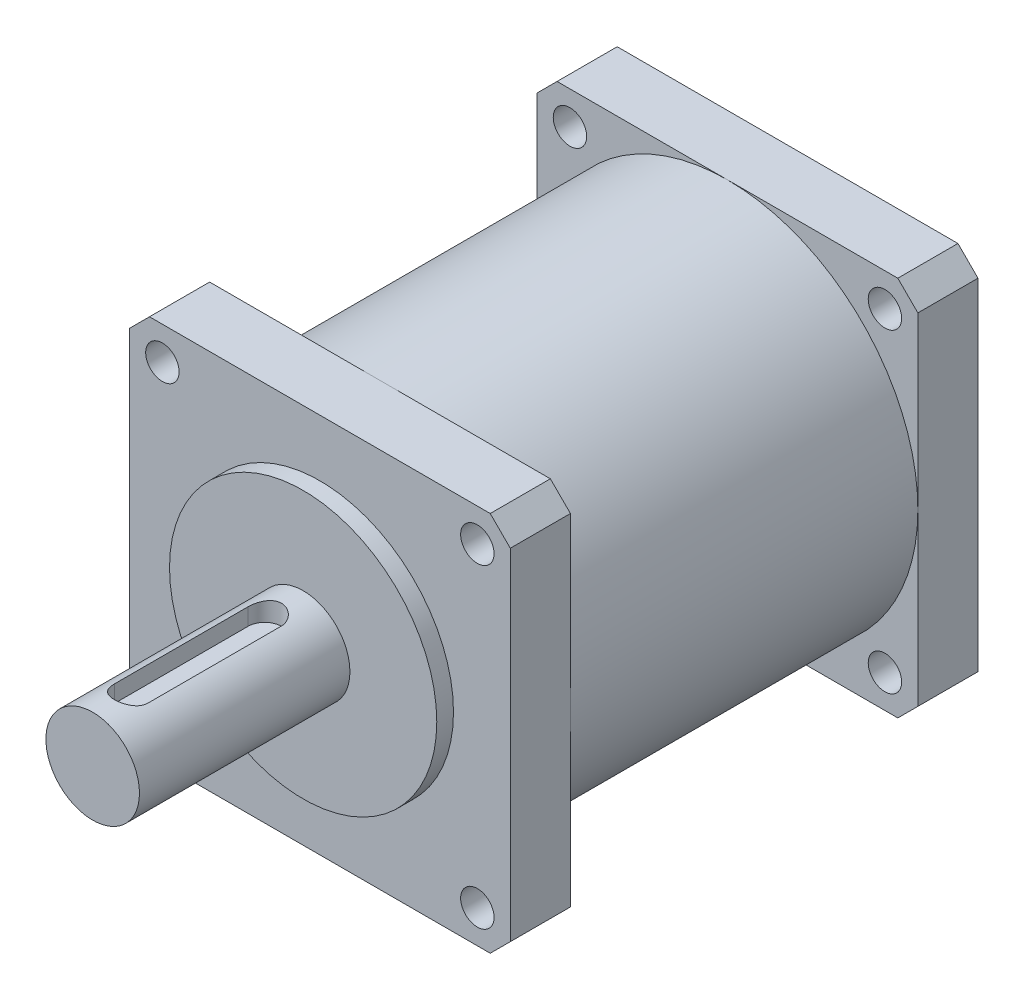
from build123d import *

# Parameters (mm, degrees)
BOSS_EXTRUDE1_DEPTH     = 70
SKETCH2_R               = 2.5
CUT_EXTRUDE1_DEPTH      = 81.774377125
CUT_EXTRUDE2_DEPTH      = 81.774377125
CUT_EXTRUDE2_DEPTH_BACK = 81.774377125
SKETCH3_W               = 52
SKETCH3_H               = 57
SKETCH4_R               = 28.5
BOSS_EXTRUDE2_DEPTH     = 52
SKETCH5_R               = 20
BOSS_EXTRUDE3_DEPTH     = 2.5
SKETCH6_R               = 7
BOSS_EXTRUDE4_DEPTH     = 31.5
CUT_EXTRUDE3_DEPTH      = 5


with BuildPart() as part:
    # Sketch1 → Boss-Extrude1 (new body)
    with BuildSketch(Plane.XY):
        Polygon((-28.5, -25.5), (-25.5, -28.5), (25.5, -28.5), (28.5, -25.5), (28.5, 25.5), (25.5, 28.5), (-25.5, 28.5), (-28.5, 25.5), align=None)
    extrude(amount=BOSS_EXTRUDE1_DEPTH)

    # Sketch2 → Cut-Extrude1 (cut, through all)
    with BuildSketch(Plane(origin=(0, 0, 0), x_dir=(-1, 0, 0), z_dir=(0, 0, -1))):
        with Locations((-23.57, 23.57)):
            Circle(SKETCH2_R)
        with Locations((-23.57, -23.57)):
            Circle(SKETCH2_R)
        with Locations((23.57, -23.57)):
            Circle(SKETCH2_R)
        with Locations((23.57, 23.57)):
            Circle(SKETCH2_R)
    extrude(amount=-CUT_EXTRUDE1_DEPTH, mode=Mode.SUBTRACT)

    # Sketch3 → Cut-Extrude2 (cut, two sides: drawn at the far end of the back side and taken through both)
    with BuildSketch(Plane(origin=(0, 0, 0), x_dir=(0, 0, -1), z_dir=(1, 0, 0)).offset(-CUT_EXTRUDE2_DEPTH_BACK)):
        with Locations((-35, 0)):
            Rectangle(SKETCH3_W, SKETCH3_H)
    extrude(amount=CUT_EXTRUDE2_DEPTH + CUT_EXTRUDE2_DEPTH_BACK, mode=Mode.SUBTRACT)


with BuildPart() as cut_extrude2_piece_1:
    # of the separate pieces the step leaves, piece 1, a body of its own (cut_extrude2_pieces)
    add(part.part.solids().sort_by_distance((-28.5, -25.5, 61))[0])



with BuildPart() as cut_extrude2_piece_2:
    # of the separate pieces the step leaves, piece 2, a body of its own (cut_extrude2_pieces)
    add(part.part.solids().sort_by_distance((-28.5, -25.5, 0))[0])


with BuildPart() as cut_extrude2_piece_1_1:
    add(cut_extrude2_piece_1.part)

    add(cut_extrude2_piece_2.part)  # Boss-Extrude2 merges Cut-Extrude2 piece 2
    # Sketch4 → Boss-Extrude2 (add)
    with BuildSketch(Plane.XY.offset(9)):
        with Locations(Location((0, 0, 0), (0, 0, 180))):
            Circle(SKETCH4_R)
    extrude(amount=BOSS_EXTRUDE2_DEPTH)

    # Sketch5 → Boss-Extrude3 (add)
    with BuildSketch(Plane.XY.offset(70)):
        Circle(SKETCH5_R)
    extrude(amount=BOSS_EXTRUDE3_DEPTH)

    # Sketch6 → Boss-Extrude4 (add)
    with BuildSketch(Plane.XY.offset(72.5)):
        Circle(SKETCH6_R)
    extrude(amount=BOSS_EXTRUDE4_DEPTH)

    # Sketch7 → Cut-Extrude3 (cut)
    with BuildSketch(Plane(origin=(0, 9, 0), x_dir=(1, 0, 0), z_dir=(0, 1, 0))):
        with BuildLine():
            Line((-2.5, -98.25), (-2.5, -78.25))
            ThreePointArc((-2.5, -78.25), (0, -75.75), (2.5, -78.25))
            Line((2.5, -78.25), (2.5, -98.25))
            ThreePointArc((2.5, -98.25), (0, -100.75), (-2.5, -98.25))
        make_face()
    extrude(amount=-CUT_EXTRUDE3_DEPTH, mode=Mode.SUBTRACT)


solid = cut_extrude2_piece_1_1.part
